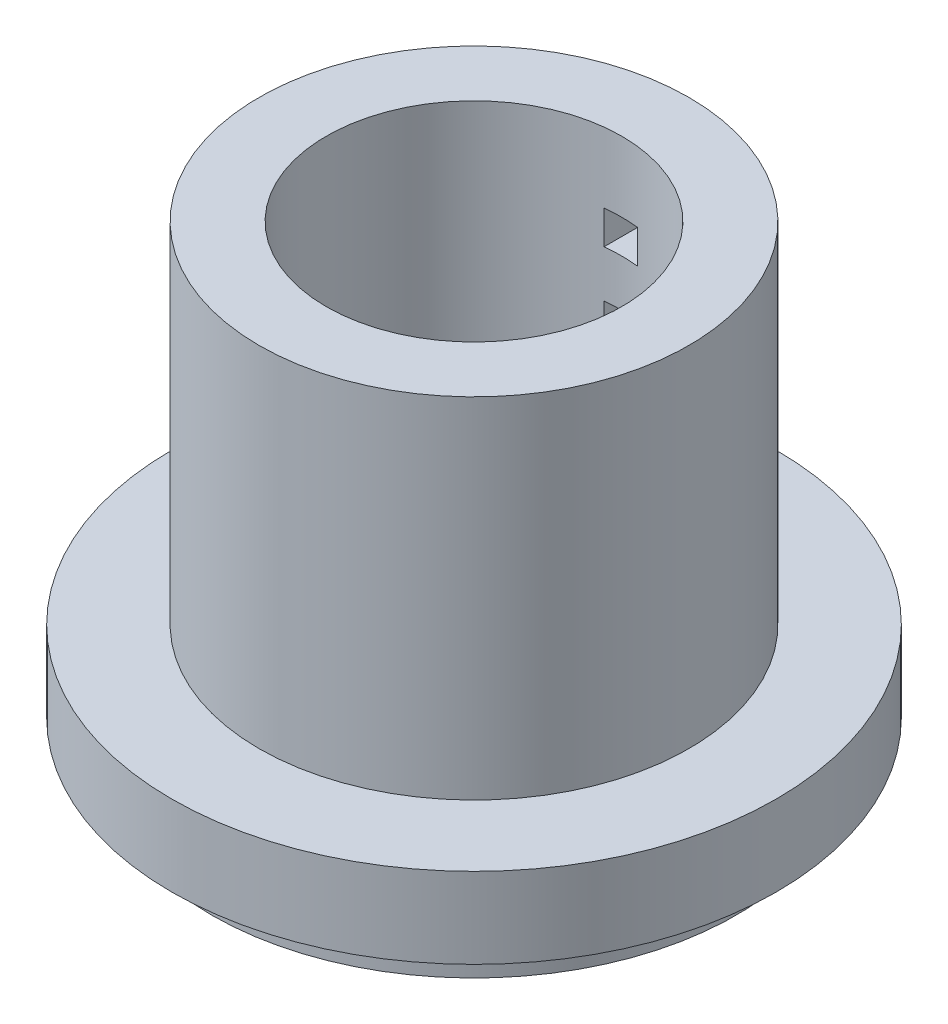
from build123d import *

# Parameters (mm, degrees)
SKETCH4_W          = 2.5
SKETCH4_H          = 2.5
CUT_EXTRUDE1_DEPTH = 20


with BuildPart() as part:
    # Sketch2 → Revolve1 (revolve)
    with BuildSketch(Plane.XY, mode=Mode.PRIVATE) as revolve1_sk:
        Polygon((11, 0), (17.5, 0), (17.5, -3), (19.5, -3), (19.5, 0), (22.5, 0), (22.5, 6), (16, 6), (16, 32), (11, 32), (11, 6), align=None)
    revolve(revolve1_sk.sketch.rotate(Axis((0, 28.805193162, 0), (0, 1, 0)), 270), axis=Axis((0, 28.805193162, 0), (0, 1, 0)))

    # Sketch4 → Cut-Extrude1 (cut)
    with BuildSketch(Plane.XY):
        with Locations((0, 13.522413215)):
            Rectangle(SKETCH4_W, SKETCH4_H)
        with Locations((0, 7.522413215)):
            Rectangle(SKETCH4_W, SKETCH4_H)
        with Locations((0, 19.522413215)):
            Rectangle(SKETCH4_W, SKETCH4_H)
        with Locations((0, 25.522413215)):
            Rectangle(SKETCH4_W, SKETCH4_H)
    extrude(amount=-CUT_EXTRUDE1_DEPTH, mode=Mode.SUBTRACT)


solid = part.part
